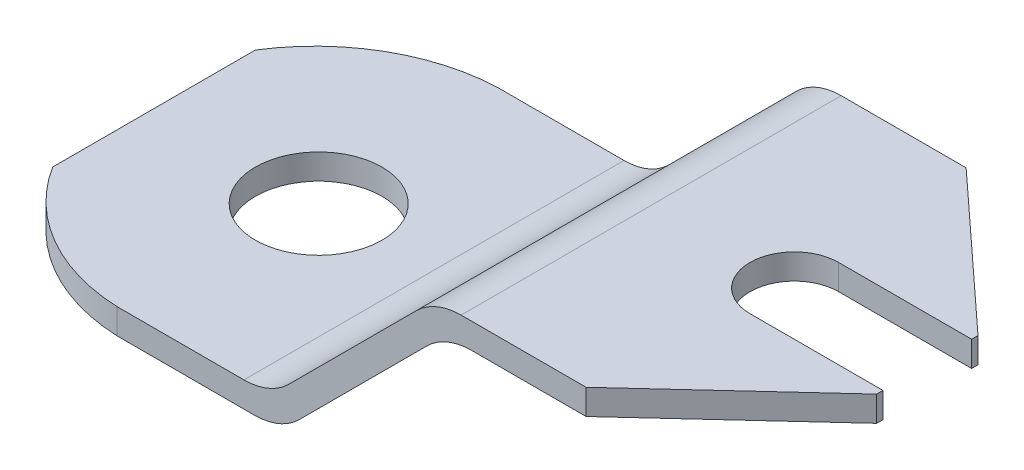
from build123d import *

# Parameters (mm, degrees)
SALIENTE_EXTRUIR1_DEPTH    = 30
CORTAR_EXTRUIR2_DEPTH      = 32
CORTAR_EXTRUIR2_DEPTH_BACK = 9
CROQUIS2_R                 = 10
CORTAR_EXTRUIR3_DEPTH      = 90
CORTAR_EXTRUIR4_DEPTH      = 130.248290693
CORTAR_EXTRUIR5_DEPTH      = 130.248290693
REDONDEO2_R                = 10
REDONDEO3_R                = 10
REDONDEO4_R                = 10


with BuildPart() as part:
    # Croquis1 → Saliente-Extruir1 (new, symmetric)
    with BuildSketch(Plane.XY):
        Polygon((0, 0), (50, 0), (76, 26), (122.086529343, 26), (122.086529343, 30), (74.343145751, 30), (48.343145751, 4), (0, 4), align=None)
    extrude(amount=SALIENTE_EXTRUIR1_DEPTH, both=True)

    # Croquis2 → Cortar-Extruir2 (cut, two sides: drawn at the far end of the back side and taken through both)
    with BuildSketch(Plane(origin=(0, 0, 0), x_dir=(1, 0, 0), z_dir=(0, 1, 0)).offset(-CORTAR_EXTRUIR2_DEPTH_BACK)):
        with Locations(Location((26, 0, 0), (0, 0, 90))):
            Circle(CROQUIS2_R)
    extrude(amount=CORTAR_EXTRUIR2_DEPTH + CORTAR_EXTRUIR2_DEPTH_BACK, mode=Mode.SUBTRACT)

    # Croquis3 → Cortar-Extruir3 (cut)
    with BuildSketch(Plane(origin=(0, 0, 0), x_dir=(1, 0, 0), z_dir=(0, 1, 0))):
        with BuildLine():
            Line((122.086529343, -7), (101.086529343, -7))
            ThreePointArc((101.086529343, -7), (94.086529343, 0), (101.086529343, 7))
            Line((101.086529343, 7), (122.086529343, 7))
            ThreePointArc((122.086529343, 7), (129.086529343, 0), (122.086529343, -7))
        make_face()
    extrude(amount=CORTAR_EXTRUIR3_DEPTH, mode=Mode.SUBTRACT)

    # Croquis4 → Cortar-Extruir4 (cut, through all)
    with BuildSketch(Plane(origin=(0, 0, 0), x_dir=(1, 0, 0), z_dir=(0, 1, 0))):
        Polygon((98.214837547, 30), (122.086529343, 8), (122.086529343, 30), align=None)
    cortar_extruir4 = extrude(amount=CORTAR_EXTRUIR4_DEPTH, mode=Mode.SUBTRACT)

    # Simetría1: Cortar-Extruir4 across plane
    add(cortar_extruir4.mirror(Plane.XY), mode=Mode.SUBTRACT)

    # Croquis5 → Cortar-Extruir5 (cut, through all)
    with BuildSketch(Plane(origin=(0, 0, 0), x_dir=(1, 0, 0), z_dir=(0, 1, 0))):
        with BuildLine():
            Line((0, 30), (24.171572875, 30))
            ThreePointArc((24.171572875, 30), (10.356957759, 25.984893458), (0, 16))
            Line((0, 16), (0, 30))
        make_face()
    cortar_extruir5 = extrude(amount=CORTAR_EXTRUIR5_DEPTH, mode=Mode.SUBTRACT)

    # Simetría2: Cortar-Extruir5 across plane
    add(cortar_extruir5.mirror(Plane.XY), mode=Mode.SUBTRACT)

    # Redondeo2
    redondeo2_edges = [part.edges().sort_by_distance(p)[0] for p in [
        (48.343145751, 4, 0),
    ]]
    fillet(redondeo2_edges, radius=REDONDEO2_R)

    # Redondeo3
    redondeo3_edges = [part.edges().sort_by_distance(p)[0] for p in [
        (74.343145751, 30, 0),
    ]]
    fillet(redondeo3_edges, radius=REDONDEO3_R)

    # Redondeo4
    redondeo4_edges = [part.edges().sort_by_distance(p)[0] for p in [
        (76, 26, 0),
        (50, 0, 0),
    ]]
    fillet(redondeo4_edges, radius=REDONDEO4_R)


solid = part.part
